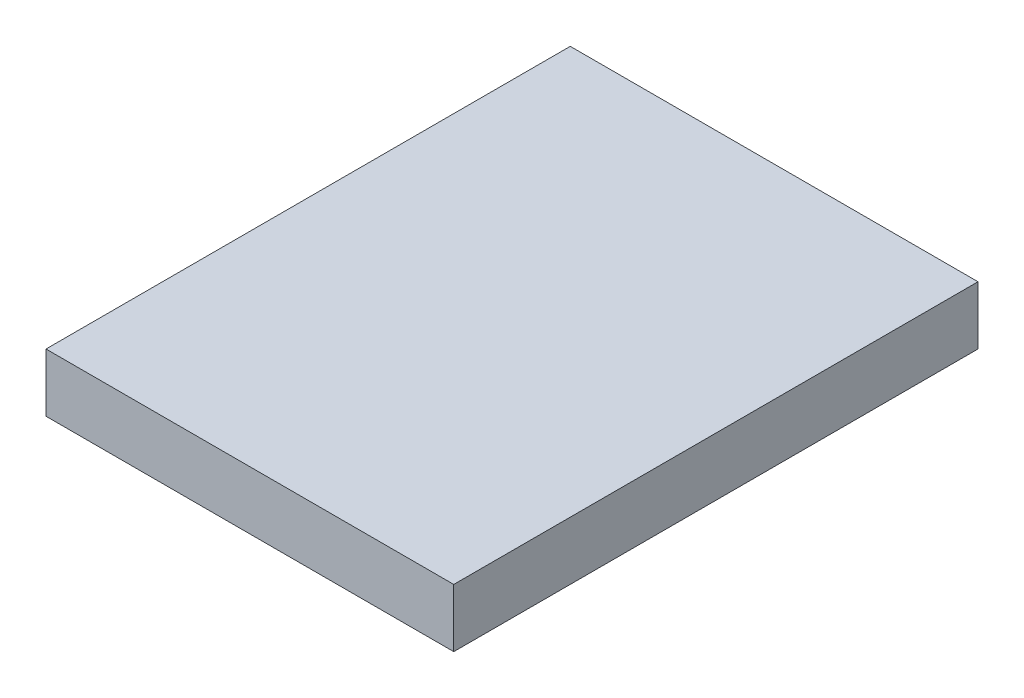
from build123d import *

# Parameters (mm, degrees)
SKETCH1_W           = 177.8
SKETCH1_H           = 25.4
BOSS_EXTRUDE1_DEPTH = 228.6


with BuildPart() as part:
    # Sketch1 → Boss-Extrude1 (new body)
    with BuildSketch(Plane.XY):
        Rectangle(SKETCH1_W, SKETCH1_H)
    extrude(amount=BOSS_EXTRUDE1_DEPTH)


solid = part.part
